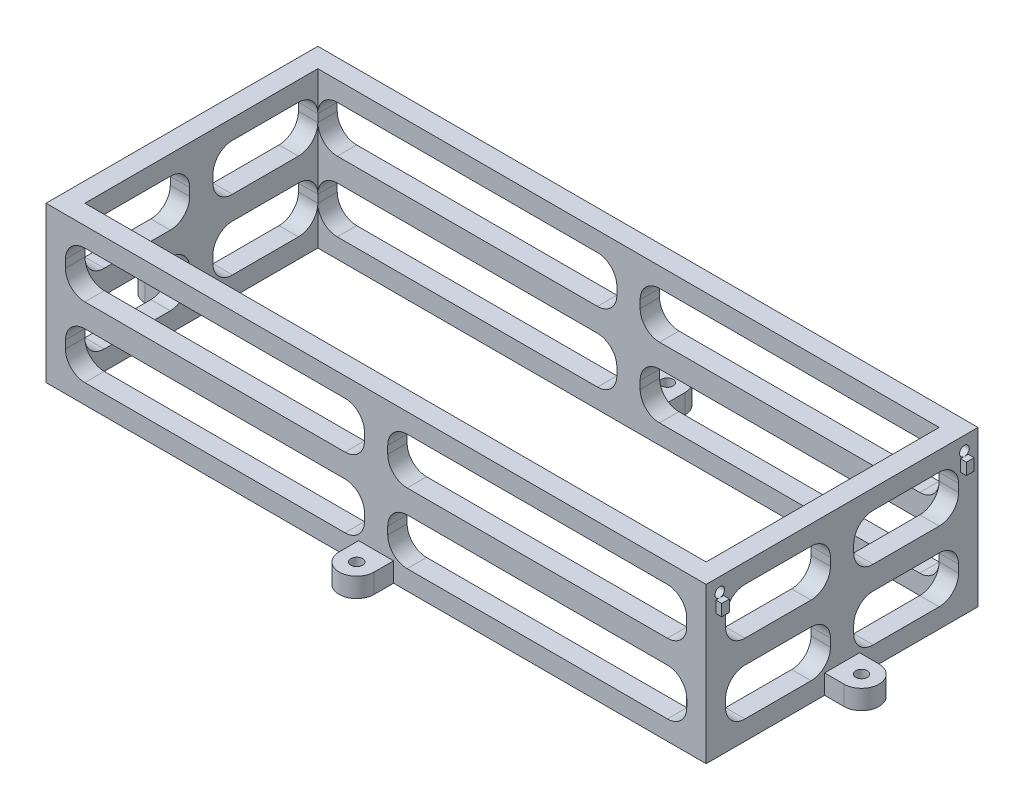
from build123d import *

# Parameters (mm, degrees)
SKETCH1_W           = 170
SKETCH1_H           = 70
BOSS_EXTRUDE1_DEPTH = 40
SHELL1_T            = -5
CUT_EXTRUDE1_DEPTH  = 170
CUT_EXTRUDE2_DEPTH  = 90
SKETCH6_R           = 4.5
SKETCH6_R_2         = 1.5
SKETCH6_W           = 9
SKETCH6_H           = 10
SKETCH6_W_2         = 10
SKETCH6_H_2         = 9
BOSS_EXTRUDE2_DEPTH = 5
SKETCH7_R           = 1.5
CUT_EXTRUDE3_DEPTH  = 5
SKETCH8_R           = 1.25
CUT_EXTRUDE4_DEPTH  = 5
CUT_EXTRUDE5_START  = -5
SKETCH9_R           = 1.25
CUT_EXTRUDE5_DEPTH  = 5
SKETCH10_W          = 2
SKETCH10_H          = 3
BOSS_EXTRUDE3_DEPTH = 1.5
SKETCH11_W          = 2
SKETCH11_H          = 3
BOSS_EXTRUDE4_DEPTH = 1.5


with BuildPart() as part:
    # Sketch1 → Boss-Extrude1 (new body)
    with BuildSketch(Plane(origin=(0, 0, 0), x_dir=(1, 0, 0), z_dir=(0, 1, 0))):
        Rectangle(SKETCH1_W, SKETCH1_H)
    extrude(amount=BOSS_EXTRUDE1_DEPTH)

    # Shell1
    shell1_openings = [part.faces().sort_by_distance(p)[0] for p in [
        (0, 40, 0),
        (0, 0, 0),
    ]]
    offset(amount=SHELL1_T, openings=shell1_openings, kind=Kind.INTERSECTION)

    # Sketch4 → Cut-Extrude1 (cut)
    with BuildSketch(Plane(origin=(85, 0, 0), x_dir=(0, 0, -1), z_dir=(1, 0, 0))):
        with BuildLine():
            Line((-25, 35), (-8, 35))
            ThreePointArc((-8, 35), (-4.464466094, 33.535533906), (-3, 30))
            Line((-3, 30), (-3, 28))
            ThreePointArc((-3, 28), (-4.464466094, 24.464466094), (-8, 23))
            Line((-8, 23), (-25, 23))
            ThreePointArc((-25, 23), (-28.535533906, 24.464466094), (-30, 28))
            Line((-30, 28), (-30, 30))
            ThreePointArc((-30, 30), (-28.535533906, 33.535533906), (-25, 35))
        make_face()
        with BuildLine():
            Line((-25, 17), (-8, 17))
            ThreePointArc((-8, 17), (-4.464466094, 15.535533906), (-3, 12))
            Line((-3, 12), (-3, 10))
            ThreePointArc((-3, 10), (-4.464466094, 6.464466094), (-8, 5))
            Line((-8, 5), (-25, 5))
            ThreePointArc((-25, 5), (-28.535533906, 6.464466094), (-30, 10))
            Line((-30, 10), (-30, 12))
            ThreePointArc((-30, 12), (-28.535533906, 15.535533906), (-25, 17))
        make_face()
        with BuildLine():
            Line((8, 35), (25, 35))
            ThreePointArc((25, 35), (28.535533906, 33.535533906), (30, 30))
            Line((30, 30), (30, 28))
            ThreePointArc((30, 28), (28.535533906, 24.464466094), (25, 23))
            Line((25, 23), (8, 23))
            ThreePointArc((8, 23), (4.464466094, 24.464466094), (3, 28))
            Line((3, 28), (3, 30))
            ThreePointArc((3, 30), (4.464466094, 33.535533906), (8, 35))
        make_face()
        with BuildLine():
            Line((8, 17), (25, 17))
            ThreePointArc((25, 17), (28.535533906, 15.535533906), (30, 12))
            Line((30, 12), (30, 10))
            ThreePointArc((30, 10), (28.535533906, 6.464466094), (25, 5))
            Line((25, 5), (8, 5))
            ThreePointArc((8, 5), (4.464466094, 6.464466094), (3, 10))
            Line((3, 10), (3, 12))
            ThreePointArc((3, 12), (4.464466094, 15.535533906), (8, 17))
        make_face()
    extrude(amount=-CUT_EXTRUDE1_DEPTH, mode=Mode.SUBTRACT)

    # Sketch5 → Cut-Extrude2 (cut)
    with BuildSketch(Plane.XY.offset(35)):
        with BuildLine():
            Line((-75, 35), (-8, 35))
            ThreePointArc((-8, 35), (-4.464466094, 33.535533906), (-3, 30))
            Line((-3, 30), (-3, 28))
            ThreePointArc((-3, 28), (-4.464466094, 24.464466094), (-8, 23))
            Line((-8, 23), (-75, 23))
            ThreePointArc((-75, 23), (-78.535533906, 24.464466094), (-80, 28))
            Line((-80, 28), (-80, 30))
            ThreePointArc((-80, 30), (-78.535533906, 33.535533906), (-75, 35))
        make_face()
        with BuildLine():
            Line((-75, 17), (-8, 17))
            ThreePointArc((-8, 17), (-4.464466094, 15.535533906), (-3, 12))
            Line((-3, 12), (-3, 10))
            ThreePointArc((-3, 10), (-4.464466094, 6.464466094), (-8, 5))
            Line((-8, 5), (-75, 5))
            ThreePointArc((-75, 5), (-78.535533906, 6.464466094), (-80, 10))
            Line((-80, 10), (-80, 12))
            ThreePointArc((-80, 12), (-78.535533906, 15.535533906), (-75, 17))
        make_face()
        with BuildLine():
            Line((8, 35), (75, 35))
            ThreePointArc((75, 35), (78.535533906, 33.535533906), (80, 30))
            Line((80, 30), (80, 28))
            ThreePointArc((80, 28), (78.535533906, 24.464466094), (75, 23))
            Line((75, 23), (8, 23))
            ThreePointArc((8, 23), (4.464466094, 24.464466094), (3, 28))
            Line((3, 28), (3, 30))
            ThreePointArc((3, 30), (4.464466094, 33.535533906), (8, 35))
        make_face()
        with BuildLine():
            Line((8, 17), (75, 17))
            ThreePointArc((75, 17), (78.535533906, 15.535533906), (80, 12))
            Line((80, 12), (80, 10))
            ThreePointArc((80, 10), (78.535533906, 6.464466094), (75, 5))
            Line((75, 5), (8, 5))
            ThreePointArc((8, 5), (4.464466094, 6.464466094), (3, 10))
            Line((3, 10), (3, 12))
            ThreePointArc((3, 12), (4.464466094, 15.535533906), (8, 17))
        make_face()
    extrude(amount=-CUT_EXTRUDE2_DEPTH, mode=Mode.SUBTRACT)

    # Sketch6 → Boss-Extrude2 (add)
    # profile 1 of 8: a face of its own
    with BuildSketch(Plane.XZ):
        with Locations((0, 40)):
            Circle(SKETCH6_R)
    # profile 2 of 8: a face of its own
    with BuildSketch(Plane.XZ):
        with Locations((90, 0)):
            Circle(SKETCH6_R)
    # profile 3 of 8: a face of its own
    with BuildSketch(Plane.XZ):
        with Locations((0, -40)):
            Circle(SKETCH6_R)
    # profile 4 of 8: a face of its own
    with BuildSketch(Plane.XZ):
        with Locations((-90, 0)):
            Circle(SKETCH6_R)
        with Locations((-90, 0)):
            Circle(SKETCH6_R_2, mode=Mode.SUBTRACT)
    # profile 5 of 8: a face of its own
    with BuildSketch(Plane.XZ):
        with Locations((0, 35)):
            Rectangle(SKETCH6_W, SKETCH6_H)
    # profile 6 of 8: a face of its own
    with BuildSketch(Plane.XZ):
        with Locations((-85, 0)):
            Rectangle(SKETCH6_W_2, SKETCH6_H_2)
    # profile 7 of 8: a face of its own
    with BuildSketch(Plane.XZ):
        with Locations((0, -35)):
            Rectangle(SKETCH6_W, SKETCH6_H)
    # profile 8 of 8: a face of its own
    with BuildSketch(Plane.XZ):
        with Locations((85, 0)):
            Rectangle(SKETCH6_W_2, SKETCH6_H_2)
    extrude(amount=-BOSS_EXTRUDE2_DEPTH)

    # Sketch7 → Cut-Extrude3 (cut)
    with BuildSketch(Plane.XZ):
        with Locations(Location((0, 40, 0), (0, 0, 270))):
            Circle(SKETCH7_R)
        with Locations(Location((-90, 0, 0), (0, 0, 270))):
            Circle(SKETCH7_R)
        with Locations(Location((0, -40, 0), (0, 0, 270))):
            Circle(SKETCH7_R)
        with Locations(Location((90, 0, 0), (0, 0, 270))):
            Circle(SKETCH7_R)
    extrude(amount=-CUT_EXTRUDE3_DEPTH, mode=Mode.SUBTRACT)

    # Sketch8 → Cut-Extrude4 (cut)
    with BuildSketch(Plane(origin=(85, 0, 0), x_dir=(0, 0, -1), z_dir=(1, 0, 0))):
        with Locations((-31.5, 36.5)):
            Circle(SKETCH8_R)
        with Locations((31.5, 36.5)):
            Circle(SKETCH8_R)
    extrude(amount=-CUT_EXTRUDE4_DEPTH, mode=Mode.SUBTRACT)

    # Sketch9 → Cut-Extrude5 (cut)
    with BuildSketch(Plane.ZY.offset(85).offset(CUT_EXTRUDE5_START)):
        with Locations(Location((-31.5, 36.5, 0), (0, 0, 180))):
            Circle(SKETCH9_R)
        with Locations(Location((31.5, 36.5, 0), (0, 0, 180))):
            Circle(SKETCH9_R)
    extrude(amount=CUT_EXTRUDE5_DEPTH, mode=Mode.SUBTRACT)

    # Sketch10 → Boss-Extrude3 (add)
    with BuildSketch(Plane.ZY.offset(85)):
        with Locations((-31.5, 33.75)):
            Rectangle(SKETCH10_W, SKETCH10_H)
        with Locations((31.5, 33.75)):
            Rectangle(SKETCH10_W, SKETCH10_H)
    extrude(amount=BOSS_EXTRUDE3_DEPTH)

    # Sketch11 → Boss-Extrude4 (add)
    with BuildSketch(Plane(origin=(85, 0, 0), x_dir=(0, 0, -1), z_dir=(1, 0, 0))):
        with Locations((-31.5, 33.75)):
            Rectangle(SKETCH11_W, SKETCH11_H)
        with Locations((31.5, 33.75)):
            Rectangle(SKETCH11_W, SKETCH11_H)
    extrude(amount=BOSS_EXTRUDE4_DEPTH)


solid = part.part
